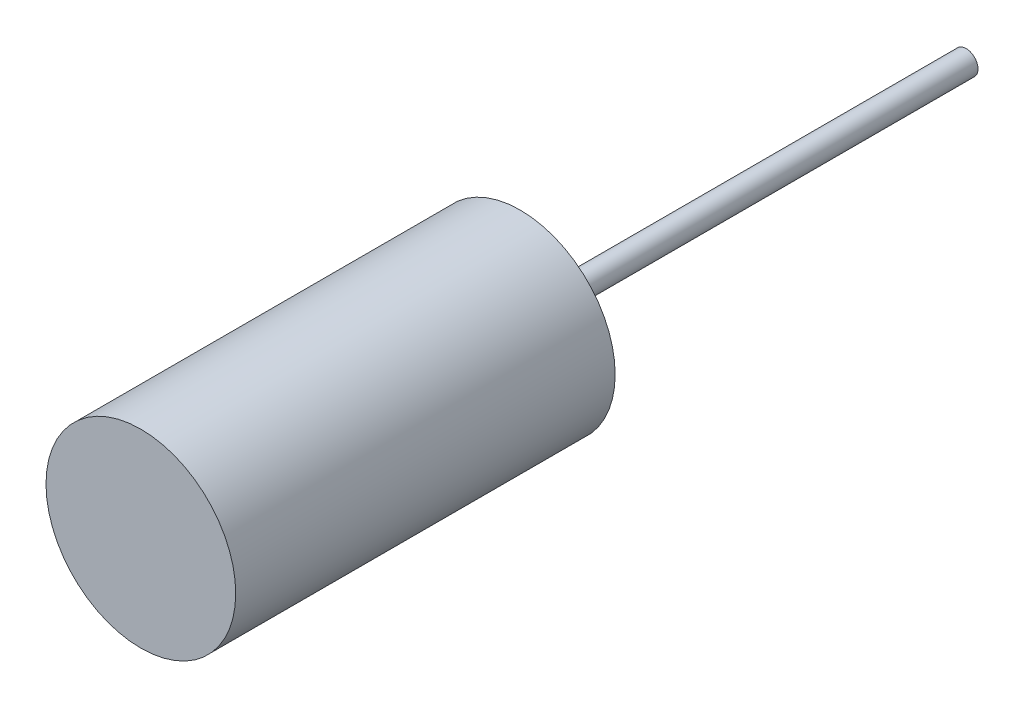
from build123d import *

# Parameters (mm, degrees)
SKETCH1_R                 = 12.7
BOSS_EXTRUDE1_DEPTH       = 50.8
SKETCH2_R                 = 1.5875
BOSS_EXTRUDE2_DEPTH       = 59.69
F_2_64_TAPPED_HOLE1_D     = 1.778
F_2_64_TAPPED_HOLE1_DEPTH = 12.7
F_2_64_TAPPED_HOLE1_TIP   = 0.53416509


with BuildPart() as part:
    # Sketch1 → Boss-Extrude1 (new body)
    with BuildSketch(Plane.XY):
        with Locations(Location((0, 0, 0), (0, 0, 180))):
            Circle(SKETCH1_R)
    extrude(amount=BOSS_EXTRUDE1_DEPTH)

    # Sketch2 → Boss-Extrude2 (add)
    with BuildSketch(Plane(origin=(0, 0, 0), x_dir=(-1, 0, 0), z_dir=(0, 0, -1))):
        with Locations(Location((0, 0, 0), (0, 0, 180))):
            Circle(SKETCH2_R)
    extrude(amount=BOSS_EXTRUDE2_DEPTH)

    # #2-64 Tapped Hole1
    with Locations(Plane(origin=(0, 0, 0), x_dir=(-1, 0, 0), z_dir=(0, 0, -1))):
        with Locations((-7.62, 7.62), (7.62, 7.62), (7.62, -7.62), (-7.62, -7.62)):
            Hole(F_2_64_TAPPED_HOLE1_D / 2, depth=F_2_64_TAPPED_HOLE1_DEPTH)
            with Locations((0, 0, -(F_2_64_TAPPED_HOLE1_DEPTH + F_2_64_TAPPED_HOLE1_TIP / 2))):  # 118° drill point
                Cone(0, F_2_64_TAPPED_HOLE1_D / 2, F_2_64_TAPPED_HOLE1_TIP, mode=Mode.SUBTRACT)


solid = part.part
